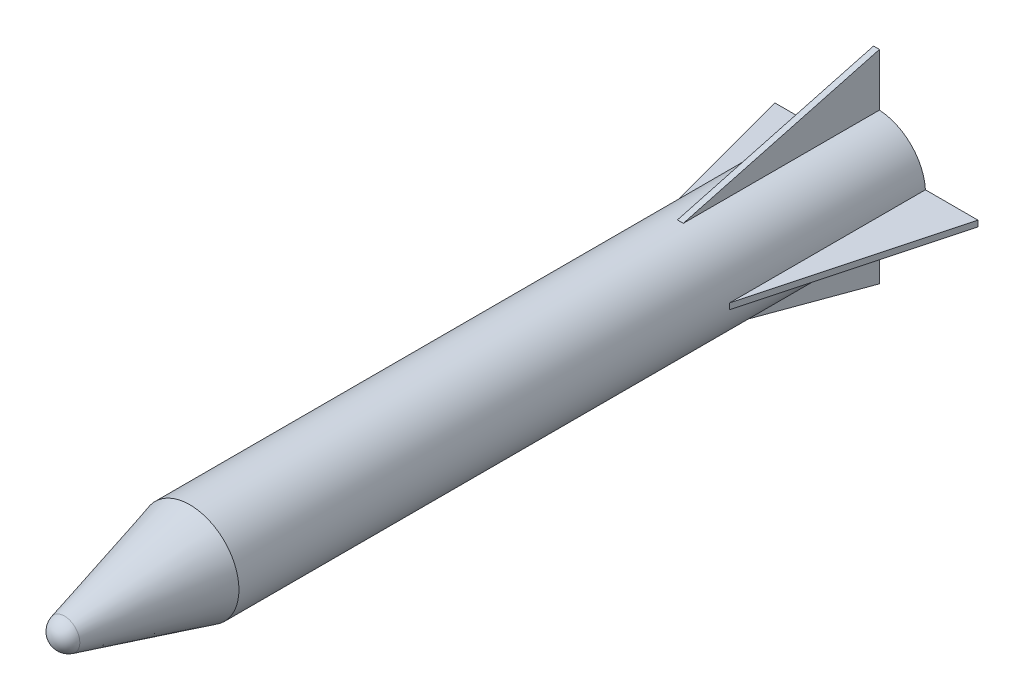
from build123d import *

# Parameters (mm, degrees)
BOSS_EXTRUDE4_REACH      = 217.236
BOSS_EXTRUDE4_END_RADIUS = 12.5
CUT_EXTRUDE1_REACH       = 214.99
CIRPATTERN9_COUNT        = 4


with BuildPart() as part:
    # Sketch1 → Revolve1 (revolve)
    with BuildSketch(Plane.YZ, mode=Mode.PRIVATE) as revolve1_sk:
        with BuildLine():
            Line((-9.5, 0), (-12.5, 0))
            Line((-12.5, 0), (-12.5, 175))
            Line((-12.5, 175), (-3.929753934, 206.98459375))
            ThreePointArc((-3.929753934, 206.98459375), (-2.476673214, 209.15928273), (0, 210))
            Line((0, 210), (0, 206.98459375))
            ThreePointArc((0, 206.98459375), (-0.867879193, 206.03204615), (-1.394318866, 204.855856328))
            Line((-1.394318866, 204.855856328), (-9.5, 174.605042507))
            Line((-9.5, 174.605042507), (-9.5, 80.5))
            Line((-9.5, 80.5), (0, 80.5))
            Line((0, 80.5), (0, 79.5))
            Line((0, 79.5), (-9.5, 70))
            Line((-9.5, 70), (-9.5, 0))
        make_face()
    revolve(revolve1_sk.sketch.rotate(Axis((0, 0, 0), (0, 0, 1)), 270), axis=Axis((0, 0, 0), (0, 0, 1)))

    # Boss-Extrude4: up to this cylinder (the profile starts outside it)
    boss_extrude4_end = Plane(origin=(0, 0, 25), z_dir=(0, 0, -1)) * Cylinder(BOSS_EXTRUDE4_END_RADIUS, 460.472, mode=Mode.PRIVATE)
    # Sketch5 → Boss-Extrude4 (add, up to the surface)
    with BuildSketch(Plane.YZ.offset(33), mode=Mode.PRIVATE) as boss_extrude4_sk1:
        Polygon((0, 0), (-0.75, 0), (-0.75, 50), (0.75, 50), (0.75, 0), align=None)
    boss_extrude4_tool1 = extrude(boss_extrude4_sk1.sketch, amount=-BOSS_EXTRUDE4_REACH, mode=Mode.PRIVATE) - boss_extrude4_end
    boss_extrude4 = boss_extrude4_tool1.solids().sort_by_distance((33, 0, 25))[0]
    add(boss_extrude4)

    # Sketch6 → Cut-Extrude1 (cut, up to next)
    with BuildSketch(Plane(origin=(0, 0.75, 0), x_dir=(-1, 0, 0), z_dir=(0, 1, 0)), mode=Mode.PRIVATE) as cut_extrude1_sk1:
        Polygon((-12.477479713, 50), (-25.874939335, 0), (-33, 0), (-33, 50), align=None)
    cut_extrude1_tool1 = extrude(cut_extrude1_sk1.sketch, amount=-CUT_EXTRUDE1_REACH, mode=Mode.PRIVATE) & part.part
    cut_extrude1 = cut_extrude1_tool1.solids().sort_by_distance((25.547093, 0.75, 29.038165))[0]
    add(cut_extrude1, mode=Mode.SUBTRACT)

    # CirPattern9: Boss-Extrude4, Cut-Extrude1 ×4 about axis
    cirpattern9_axis = Axis((0, 0, 0), (0, 0, 1))
    add([boss_extrude4.rotate(cirpattern9_axis, i * 360 / CIRPATTERN9_COUNT) for i in range(1, CIRPATTERN9_COUNT)])
    add([cut_extrude1.rotate(cirpattern9_axis, i * 360 / CIRPATTERN9_COUNT) for i in range(1, CIRPATTERN9_COUNT)], mode=Mode.SUBTRACT)


solid = part.part
